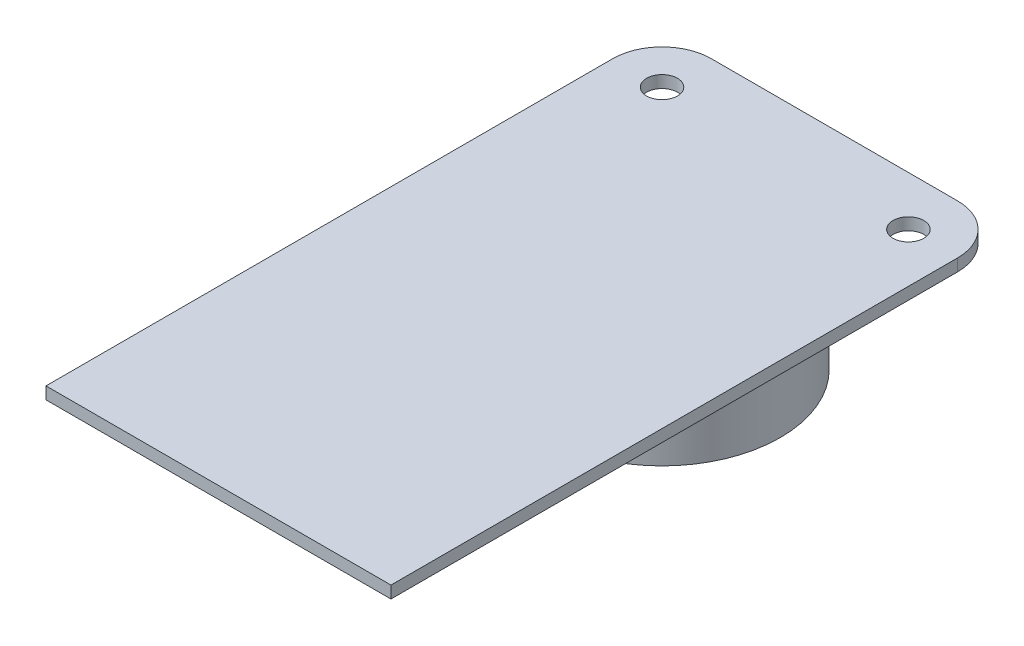
from build123d import *

# Parameters (mm, degrees)
SKETCH1_R           = 0.635
BOSS_EXTRUDE1_DEPTH = 0.5
SKETCH2_R           = 4.875
BOSS_EXTRUDE2_DEPTH = 4.5


with BuildPart() as part:
    # Sketch1 → Boss-Extrude1 (new body)
    with BuildSketch(Plane(origin=(0, 0, 0), x_dir=(1, 0, 0), z_dir=(0, 1, 0))):
        with BuildLine():
            Line((-5.08, 7.112), (5.08, 7.112))
            ThreePointArc((5.08, 7.112), (6.516840979, 6.516840979), (7.112, 5.08))
            Line((7.112, 5.08), (7.112, -18.288))
            Line((7.112, -18.288), (-7.112, -18.288))
            Line((-7.112, -18.288), (-7.112, 5.08))
            ThreePointArc((-7.112, 5.08), (-6.516840979, 6.516840979), (-5.08, 7.112))
        make_face()
        with Locations(Location((5.08, 5.08, 0), (0, 0, 270))):
            Circle(SKETCH1_R, mode=Mode.SUBTRACT)
        with Locations(Location((-5.08, 5.08, 0), (0, 0, 270))):
            Circle(SKETCH1_R, mode=Mode.SUBTRACT)
    extrude(amount=BOSS_EXTRUDE1_DEPTH)

    # Sketch2 → Boss-Extrude2 (add)
    with BuildSketch(Plane(origin=(0, 0, 0), x_dir=(1, 0, 0), z_dir=(0, 1, 0))):
        with Locations(Location((0, 0, 0), (0, 0, 270))):
            Circle(SKETCH2_R)
    extrude(amount=-BOSS_EXTRUDE2_DEPTH)


solid = part.part
